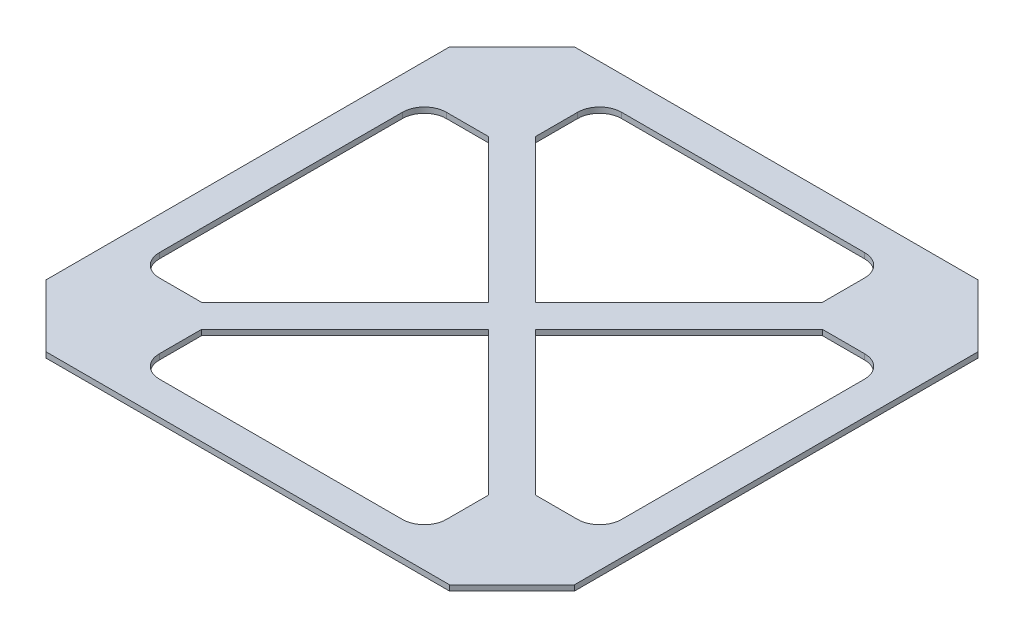
from build123d import *

# Parameters (mm, degrees)
BOSS_EXTRUDE1_DEPTH = 3.175


with BuildPart() as part:
    # Sketch2 → Boss-Extrude1 (new body)
    with BuildSketch(Plane(origin=(0, 0, 0), x_dir=(1, 0, 0), z_dir=(0, 1, 0))):
        Polygon((-152.4, 116.478975516), (-116.478975516, 152.4), (116.478975516, 152.4), (152.4, 116.478975516), (152.4, -116.478975516), (116.478975516, -152.4), (-116.478975516, -152.4), (-152.4, -116.478975516), align=None)
        with BuildLine():
            Line((-82.803015062, 96.273399243), (0, 13.470384182))
            Line((0, 13.470384182), (82.803015062, 96.273399243))
            Line((82.803015062, 96.273399243), (82.803015062, 120.65))
            ThreePointArc((82.803015062, 120.65), (79.083271183, 129.630256121), (70.103015062, 133.35))
            Line((70.103015062, 133.35), (-70.103015062, 133.35))
            ThreePointArc((-70.103015062, 133.35), (-79.083271183, 129.630256121), (-82.803015062, 120.65))
            Line((-82.803015062, 120.65), (-82.803015062, 96.273399243))
        make_face(mode=Mode.SUBTRACT)
        with BuildLine():
            Line((-133.35, 70.103015062), (-133.35, -70.103015062))
            ThreePointArc((-133.35, -70.103015062), (-129.630256121, -79.083271183), (-120.65, -82.803015062))
            Line((-120.65, -82.803015062), (-96.273399243, -82.803015062))
            Line((-96.273399243, -82.803015062), (-13.470384182, 0))
            Line((-13.470384182, 0), (-96.273399243, 82.803015062))
            Line((-96.273399243, 82.803015062), (-120.65, 82.803015062))
            ThreePointArc((-120.65, 82.803015062), (-129.630256121, 79.083271183), (-133.35, 70.103015062))
        make_face(mode=Mode.SUBTRACT)
        with BuildLine():
            Line((96.273399243, 82.803015062), (120.65, 82.803015062))
            ThreePointArc((120.65, 82.803015062), (129.630256121, 79.083271183), (133.35, 70.103015062))
            Line((133.35, 70.103015062), (133.35, -70.103015062))
            ThreePointArc((133.35, -70.103015062), (129.630256121, -79.083271183), (120.65, -82.803015062))
            Line((120.65, -82.803015062), (96.273399243, -82.803015062))
            Line((96.273399243, -82.803015062), (13.470384182, 0))
            Line((13.470384182, 0), (96.273399243, 82.803015062))
        make_face(mode=Mode.SUBTRACT)
        with BuildLine():
            Line((-70.103015062, -133.35), (70.103015062, -133.35))
            ThreePointArc((70.103015062, -133.35), (79.083271183, -129.630256121), (82.803015062, -120.65))
            Line((82.803015062, -120.65), (82.803015062, -96.273399243))
            Line((82.803015062, -96.273399243), (0, -13.470384182))
            Line((0, -13.470384182), (-82.803015062, -96.273399243))
            Line((-82.803015062, -96.273399243), (-82.803015062, -120.65))
            ThreePointArc((-82.803015062, -120.65), (-79.083271183, -129.630256121), (-70.103015062, -133.35))
        make_face(mode=Mode.SUBTRACT)
    extrude(amount=BOSS_EXTRUDE1_DEPTH)


solid = part.part
